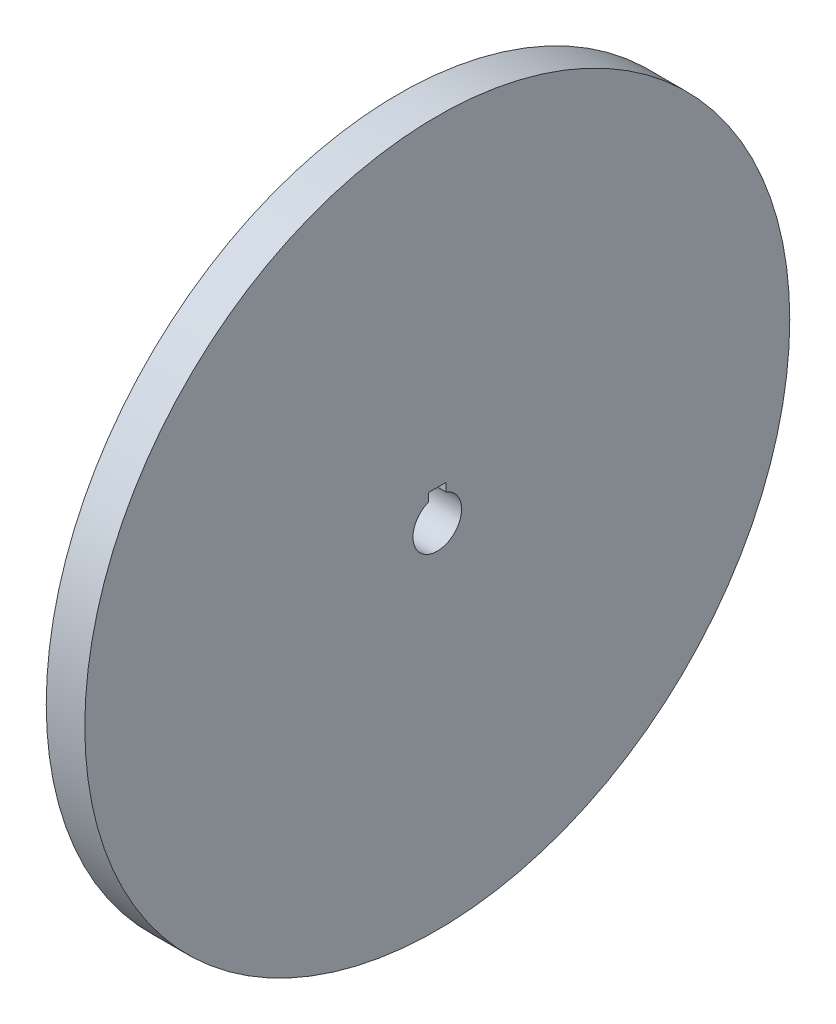
from build123d import *

# Parameters (mm, degrees)
SKETCH1_R           = 101.6
BOSS_EXTRUDE1_DEPTH = 5.55625


with BuildPart() as part:
    # Sketch1 → Boss-Extrude1 (new, symmetric)
    with BuildSketch(Plane(origin=(0, 0, 0), x_dir=(0, 0, -1), z_dir=(1, 0, 0))):
        Circle(SKETCH1_R)
        with BuildLine():
            Line((-2.5, 6.538348415), (-2.5, 8.9))
            Line((-2.5, 8.9), (2.5, 8.9))
            Line((2.5, 8.9), (2.5, 6.538348415))
            ThreePointArc((2.5, 6.538348415), (0, -7), (-2.5, 6.538348415))
        make_face(mode=Mode.SUBTRACT)
    extrude(amount=BOSS_EXTRUDE1_DEPTH, both=True)


solid = part.part
